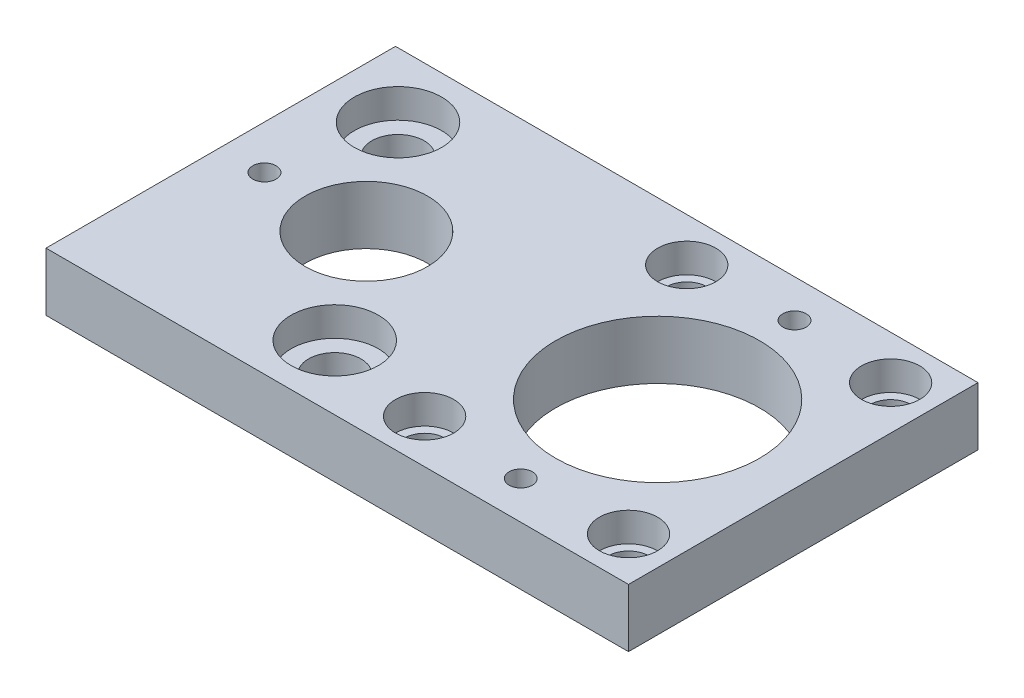
from build123d import *

# Parameters (mm, degrees)
SKETCH_1_W          = 20
SKETCH_1_H          = 12
SKETCH_1_R          = 2.1
SKETCH_1_R_2        = 3.5
EXTRUDE_1_DEPTH     = 2
SKETCH_2_R          = 0.9
SKETCH_2_R_2        = 0.7
CUT_EXTRUDE_1_DEPTH = 24.409399821
CUT_EXTRUDE_START   = 2
SKETCH_2_3_R        = 1.5
CUT_EXTRUDE_2_DEPTH = 1
SKETCH_2_4_R        = 1
CUT_EXTRUDE_3_DEPTH = 1
SKETCH_5_R          = 0.4
CUT_EXTRUDE_4_DEPTH = 24.59745749


with BuildPart() as part:
    # 草图1 → 凸台-拉伸1 (new body)
    with BuildSketch(Plane(origin=(0, 0, 0), x_dir=(1, 0, 0), z_dir=(0, 1, 0))):
        with Locations((10, -6)):
            Rectangle(SKETCH_1_W, SKETCH_1_H)
        with Locations(Location((5, -6, 0), (0, 0, 270))):
            Circle(SKETCH_1_R, mode=Mode.SUBTRACT)
        with Locations(Location((15, -6, 0), (0, 0, 270))):
            Circle(SKETCH_1_R_2, mode=Mode.SUBTRACT)
    extrude(amount=EXTRUDE_1_DEPTH)

    # 草图2 → 切除-拉伸1 (cut, through all)
    with BuildSketch(Plane(origin=(0, 0, 0), x_dir=(1, 0, 0), z_dir=(0, 1, 0))):
        with Locations(Location((2.3, -2.214171161, 0), (0, 0, 270))):
            Circle(SKETCH_2_R)
        with Locations(Location((7.7, -9.785828839, 0), (0, 0, 270))):
            Circle(SKETCH_2_R)
        with Locations(Location((11.5, -1.5, 0), (0, 0, 270))):
            Circle(SKETCH_2_R_2)
        with Locations(Location((18.5, -10.5, 0), (0, 0, 270))):
            Circle(SKETCH_2_R_2)
        with Locations(Location((18.5, -1.5, 0), (0, 0, 270))):
            Circle(SKETCH_2_R_2)
        with Locations(Location((11.5, -10.5, 0), (0, 0, 270))):
            Circle(SKETCH_2_R_2)
    extrude(amount=CUT_EXTRUDE_1_DEPTH, mode=Mode.SUBTRACT)

    # 草图2<3> → 切除-拉伸2 (cut)
    with BuildSketch(Plane(origin=(0, 0, 0), x_dir=(1, 0, 0), z_dir=(0, 1, 0)).offset(CUT_EXTRUDE_START)):
        with Locations(Location((2.3, -2.214171161, 0), (0, 0, 270))):
            Circle(SKETCH_2_3_R)
        with Locations(Location((7.7, -9.785828839, 0), (0, 0, 270))):
            Circle(SKETCH_2_3_R)
    extrude(amount=-CUT_EXTRUDE_2_DEPTH, mode=Mode.SUBTRACT)

    # 草图2<4> → 切除-拉伸3 (cut)
    with BuildSketch(Plane(origin=(0, 0, 0), x_dir=(1, 0, 0), z_dir=(0, 1, 0)).offset(CUT_EXTRUDE_START)):
        with Locations(Location((11.5, -1.5, 0), (0, 0, 270))):
            Circle(SKETCH_2_4_R)
        with Locations(Location((18.5, -10.5, 0), (0, 0, 270))):
            Circle(SKETCH_2_4_R)
        with Locations(Location((18.5, -1.5, 0), (0, 0, 270))):
            Circle(SKETCH_2_4_R)
        with Locations(Location((11.5, -10.5, 0), (0, 0, 270))):
            Circle(SKETCH_2_4_R)
    extrude(amount=-CUT_EXTRUDE_3_DEPTH, mode=Mode.SUBTRACT)

    # 草图5 → 切除-拉伸4 (cut, through all)
    with BuildSketch(Plane(origin=(5, -15.2, 6), x_dir=(0, 0, -1), z_dir=(0, 1, 0))):
        with Locations(Location((0, 3.5, 0), (0, 0, 180))):
            Circle(SKETCH_5_R)
        with Locations(Location((-4.7, -10, 0), (0, 0, 180))):
            Circle(SKETCH_5_R)
        with Locations(Location((4.7, -10, 0), (0, 0, 180))):
            Circle(SKETCH_5_R)
    extrude(amount=CUT_EXTRUDE_4_DEPTH, mode=Mode.SUBTRACT)


solid = part.part
